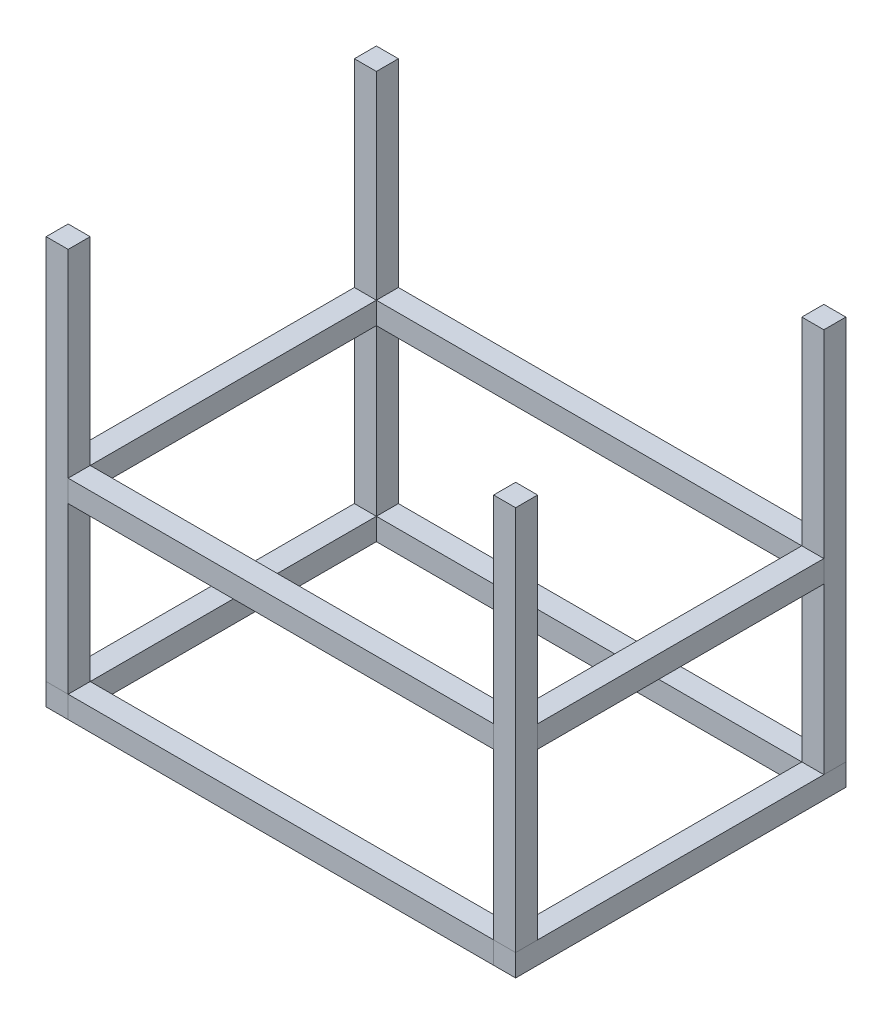
from build123d import *

# Parameters (mm, degrees)
SKETCH_5_W         = 40
SKETCH_5_H         = 40
EXTRUDE_3_DEPTH    = 600
EXTRUDE_3_2_DEPTH  = 600
SKETCH_6_W         = 40
SKETCH_6_H         = 40
EXTRUDE_5_DEPTH    = 773
SKETCH_6_W_2       = 39.998363096
EXTRUDE_5_2_DEPTH  = 773
SKETCH_7_W         = 40
SKETCH_7_H         = 39.998363096
EXTRUDE_6_DEPTH    = 700
EXTRUDE_6_2_DEPTH  = 700
SKETCH_7_H_2       = 40
EXTRUDE_6_3_DEPTH  = 700
EXTRUDE_6_4_DEPTH  = 700
SKETCH_10_W        = 40
SKETCH_10_H        = 40
EXTRUDE_9_DEPTH    = 773
SKETCH_10_W_2      = 39.998363096
EXTRUDE_9_2_DEPTH  = 773
SKETCH_11_W        = 40
SKETCH_11_H        = 40
EXTRUDE_10_DEPTH   = 520
EXTRUDE_10_2_DEPTH = 520


with BuildPart() as part:
    # ｽｹｯﾁ5 → ﾎﾞｽ - 押し出し3 (new body)
    with BuildSketch(Plane.XY):
        with Locations((38.235651977, -20)):
            Rectangle(SKETCH_5_W, SKETCH_5_H)
    extrude(amount=EXTRUDE_3_DEPTH)


with BuildPart() as body_2:
    # ｽｹｯﾁ5 → Extrude 3 2 (new body)
    with BuildSketch(Plane.XY):
        with Locations((851.235651977, -20)):
            Rectangle(SKETCH_5_W, SKETCH_5_H)
    extrude(amount=EXTRUDE_3_2_DEPTH)


with BuildPart() as body_3:
    # ｽｹｯﾁ6 → ﾎﾞｽ - 押し出し5 (new body)
    with BuildSketch(Plane(origin=(58.235651977, 0, 0), x_dir=(0, 0, -1), z_dir=(1, 0, 0))):
        with Locations((-580, -20)):
            Rectangle(SKETCH_6_W, SKETCH_6_H)
    extrude(amount=EXTRUDE_5_DEPTH)


with BuildPart() as body_4:
    # ｽｹｯﾁ6 → Extrude 5 2 (new body)
    with BuildSketch(Plane(origin=(58.235651977, 0, 0), x_dir=(0, 0, -1), z_dir=(1, 0, 0))):
        with Locations((-19.999181548, -20)):
            Rectangle(SKETCH_6_W_2, SKETCH_6_H)
    extrude(amount=EXTRUDE_5_2_DEPTH)


with BuildPart() as body_5:
    # ｽｹｯﾁ7 → ﾎﾞｽ - 押し出し6 (new body)
    with BuildSketch(Plane(origin=(0, 0, 0), x_dir=(1, 0, 0), z_dir=(0, 1, 0))):
        with Locations((38.235651977, -19.999181548)):
            Rectangle(SKETCH_7_W, SKETCH_7_H)
    extrude(amount=EXTRUDE_6_DEPTH)


with BuildPart() as body_6:
    # ｽｹｯﾁ7 → Extrude 6 2 (new body)
    with BuildSketch(Plane(origin=(0, 0, 0), x_dir=(1, 0, 0), z_dir=(0, 1, 0))):
        with Locations((851.235651977, -19.999181548)):
            Rectangle(SKETCH_7_W, SKETCH_7_H)
    extrude(amount=EXTRUDE_6_2_DEPTH)


with BuildPart() as body_7:
    # ｽｹｯﾁ7 → Extrude 6 3 (new body)
    with BuildSketch(Plane(origin=(0, 0, 0), x_dir=(1, 0, 0), z_dir=(0, 1, 0))):
        with Locations((38.235651977, -580)):
            Rectangle(SKETCH_7_W, SKETCH_7_H_2)
    extrude(amount=EXTRUDE_6_3_DEPTH)


with BuildPart() as body_8:
    # ｽｹｯﾁ7 → Extrude 6 4 (new body)
    with BuildSketch(Plane(origin=(0, 0, 0), x_dir=(1, 0, 0), z_dir=(0, 1, 0))):
        with Locations((851.235651977, -580)):
            Rectangle(SKETCH_7_W, SKETCH_7_H_2)
    extrude(amount=EXTRUDE_6_4_DEPTH)


with BuildPart() as body_9:
    # ｽｹｯﾁ10 → ﾎﾞｽ - 押し出し9 (new body)
    with BuildSketch(Plane(origin=(58.235651977, 0, 0), x_dir=(0, 0, -1), z_dir=(1, 0, 0))):
        with Locations((-580, 320)):
            Rectangle(SKETCH_10_W, SKETCH_10_H)
    extrude(amount=EXTRUDE_9_DEPTH)


with BuildPart() as body_10:
    # ｽｹｯﾁ10 → Extrude 9 2 (new body)
    with BuildSketch(Plane(origin=(58.235651977, 0, 0), x_dir=(0, 0, -1), z_dir=(1, 0, 0))):
        with Locations((-19.999181548, 320)):
            Rectangle(SKETCH_10_W_2, SKETCH_10_H)
    extrude(amount=EXTRUDE_9_2_DEPTH)


with BuildPart() as body_11:
    # ｽｹｯﾁ11 → ﾎﾞｽ - 押し出し10 (new body)
    with BuildSketch(Plane(origin=(0, 0, 560), x_dir=(-1, 0, 0), z_dir=(0, 0, -1))):
        with Locations((-851.235651977, 320)):
            Rectangle(SKETCH_11_W, SKETCH_11_H)
    extrude(amount=EXTRUDE_10_DEPTH)


with BuildPart() as body_12:
    # ｽｹｯﾁ11 → Extrude 10 2 (new body)
    with BuildSketch(Plane(origin=(0, 0, 560), x_dir=(-1, 0, 0), z_dir=(0, 0, -1))):
        with Locations((-38.235651977, 320)):
            Rectangle(SKETCH_11_W, SKETCH_11_H)
    extrude(amount=EXTRUDE_10_2_DEPTH)


solid = Compound([part.part, body_2.part, body_3.part, body_4.part, body_5.part, body_6.part, body_7.part, body_8.part, body_9.part, body_10.part, body_11.part, body_12.part])
